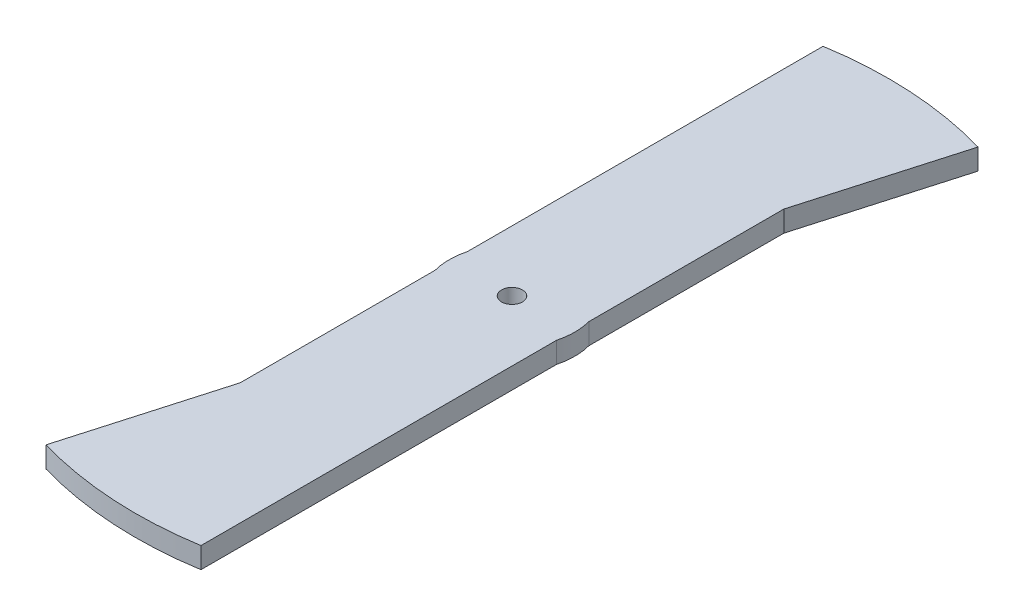
from build123d import *

# Parameters (mm, degrees)
SKETCH1_R           = 3.175
BOSS_EXTRUDE1_DEPTH = 6.35


with BuildPart() as part:
    # Sketch1 → Boss-Extrude1 (new body)
    with BuildSketch(Plane(origin=(0, 0, 0), x_dir=(1, 0, 0), z_dir=(0, 1, 0))):
        with BuildLine():
            ThreePointArc((18.415, 4.87752755), (19.05, 0), (18.415, -4.87752755))
            Line((18.415, -4.87752755), (18.415, -112.806816173))
            ThreePointArc((18.415, -112.806816173), (-6.740459718, -114.101078885), (-31.568571429, -109.854063639))
            Line((-31.568571429, -109.854063639), (-18.415, -64.081537123))
            Line((-18.415, -64.081537123), (-18.415, -4.87752755))
            ThreePointArc((-18.415, -4.87752755), (-19.05, 0), (-18.415, 4.87752755))
            Line((-18.415, 4.87752755), (-18.415, 112.806816173))
            ThreePointArc((-18.415, 112.806816173), (6.740459718, 114.101078885), (31.568571429, 109.854063639))
            Line((31.568571429, 109.854063639), (18.415, 64.081537123))
            Line((18.415, 64.081537123), (18.415, 4.87752755))
        make_face()
        with Locations(Location((0, 0, 0), (0, 0, 270))):
            Circle(SKETCH1_R, mode=Mode.SUBTRACT)
    extrude(amount=BOSS_EXTRUDE1_DEPTH)


solid = part.part
